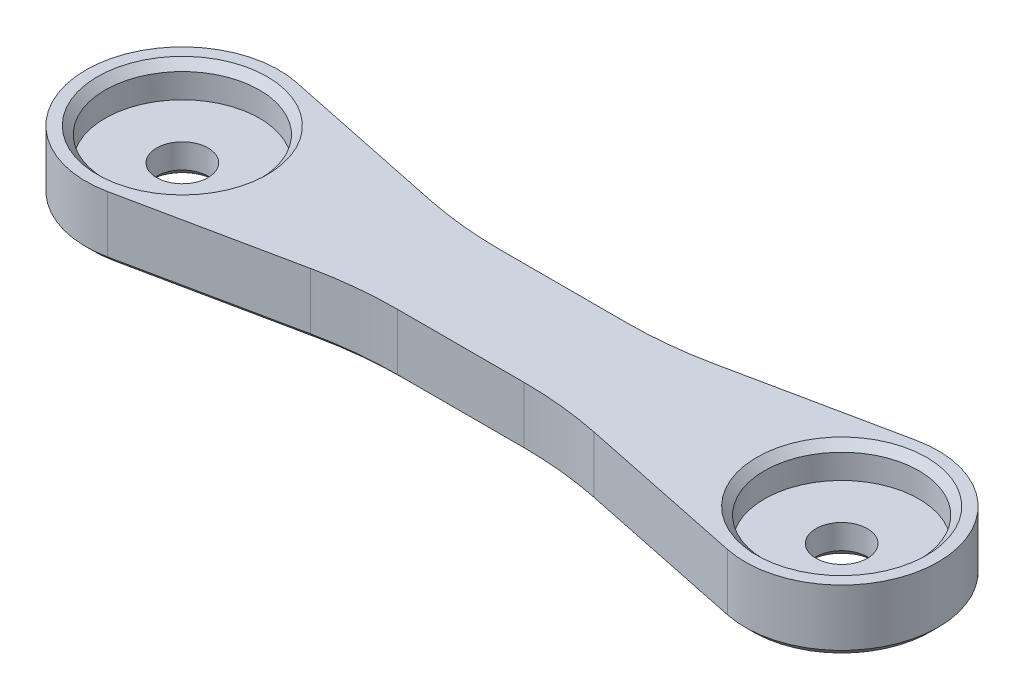
from build123d import *

# Parameters (mm, degrees)
SKETCH1_R           = 2
BOSS_EXTRUDE1_DEPTH = 5
SKETCH1_3_R         = 6
SKETCH1_3_R_2       = 2
CUT_EXTRUDE1_DEPTH  = 2.5
FILLET1_R           = 30
CHAMFER1_SIZE       = 0.6
CHAMFER2_SIZE       = 0.6


with BuildPart() as part:
    # Sketch1 → Boss-Extrude1 (new body)
    with BuildSketch(Plane(origin=(0, 0, 0), x_dir=(1, 0, 0), z_dir=(0, 1, 0))):
        with BuildLine():
            Line((8, 4), (-8, 4))
            Line((-8, 4), (-24.100084087, 7.343339258))
            ThreePointArc((-24.100084087, 7.343339258), (-33.125, 0), (-24.100084087, -7.343339258))
            Line((-24.100084087, -7.343339258), (-8, -4))
            Line((-8, -4), (8, -4))
            Line((8, -4), (24.100084087, -7.343339258))
            ThreePointArc((24.100084087, -7.343339258), (33.125, 0), (24.100084087, 7.343339258))
            Line((24.100084087, 7.343339258), (8, 4))
        make_face()
        with Locations((-25.625, 0)):
            Circle(SKETCH1_R, mode=Mode.SUBTRACT)
        with Locations((25.625, 0)):
            Circle(SKETCH1_R, mode=Mode.SUBTRACT)
    extrude(amount=-BOSS_EXTRUDE1_DEPTH)

    # Sketch1<3> → Cut-Extrude1 (cut)
    # profile 1 of 2: a face of its own
    with BuildSketch(Plane(origin=(0, 0, 0), x_dir=(1, 0, 0), z_dir=(0, 1, 0))):
        with Locations((-25.625, 0)):
            Circle(SKETCH1_3_R)
        with Locations((-25.625, 0)):
            Circle(SKETCH1_3_R_2, mode=Mode.SUBTRACT)
    # profile 2 of 2: a face of its own
    with BuildSketch(Plane(origin=(0, 0, 0), x_dir=(1, 0, 0), z_dir=(0, 1, 0))):
        with Locations((25.625, 0)):
            Circle(SKETCH1_3_R)
        with Locations((25.625, 0)):
            Circle(SKETCH1_3_R_2, mode=Mode.SUBTRACT)
    extrude(amount=-CUT_EXTRUDE1_DEPTH, mode=Mode.SUBTRACT)

    # Fillet1
    fillet1_edges = [part.edges().sort_by_distance(p)[0] for p in [
        (8, -2.5, -4),
        (-8, -2.5, -4),
        (8, -2.5, 4),
        (-8, -2.5, 4),
    ]]
    fillet(fillet1_edges, radius=FILLET1_R)

    # Chamfer1
    chamfer1_edges = [part.edges().sort_by_distance(p)[0] for p in [
        (-33.125, -5, 0),
        (-17.558863569, -5, 5.984991113),
        (0, -5, 4),
        (17.558863569, -5, 5.984991113),
        (33.125, -5, 0),
        (17.558863569, -5, -5.984991113),
        (0, -5, -4),
        (-17.558863569, -5, -5.984991113),
        (-27.625, -5, 0),
        (23.625, -5, 0),
        (-7.983863369, -5, 4.157071935),
        (7.983863369, -5, 4.157071935),
        (7.983863369, -5, -4.157071935),
        (-7.983863369, -5, -4.157071935),
    ]]
    chamfer(chamfer1_edges, length=CHAMFER1_SIZE)

    # Chamfer2
    chamfer2_edges = [part.edges().sort_by_distance(p)[0] for p in [
        (19.625, 0, 0),
        (-31.625, 0, 0),
    ]]
    chamfer(chamfer2_edges, length=CHAMFER2_SIZE)


solid = part.part
